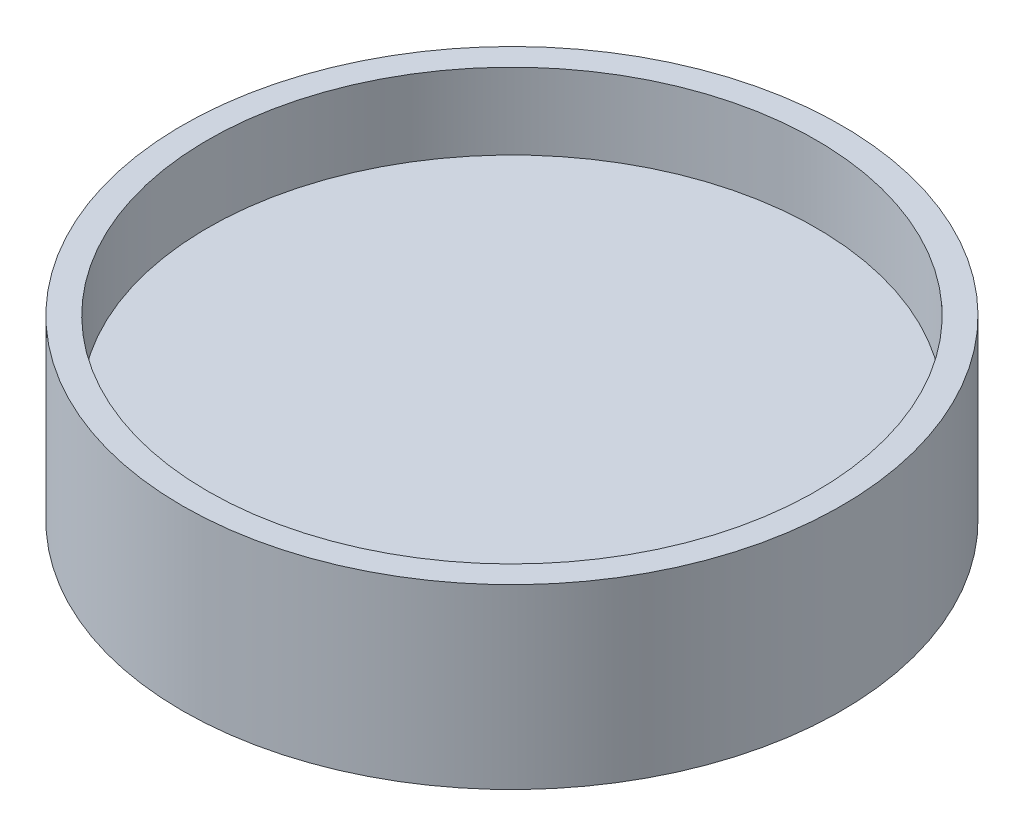
from build123d import *

# Parameters (mm, degrees)
SKETCH_1_R          = 13
EXTRUDE_1_DEPTH     = 7
SKETCH_2_R          = 12
CUT_EXTRUDE_1_DEPTH = 3


with BuildPart() as part:
    # 草图1 → 凸台-拉伸1 (new body)
    with BuildSketch(Plane(origin=(0, 0, 0), x_dir=(1, 0, 0), z_dir=(0, 1, 0))):
        with Locations(Location((0, 0, 0), (0, 0, 270))):
            Circle(SKETCH_1_R)
    extrude(amount=EXTRUDE_1_DEPTH)

    # 草图2 → 切除-拉伸1 (cut)
    with BuildSketch(Plane(origin=(0, 7, 0), x_dir=(1, 0, 0), z_dir=(0, 1, 0))):
        with Locations(Location((0, 0, 0), (0, 0, 270))):
            Circle(SKETCH_2_R)
    extrude(amount=-CUT_EXTRUDE_1_DEPTH, mode=Mode.SUBTRACT)


solid = part.part
